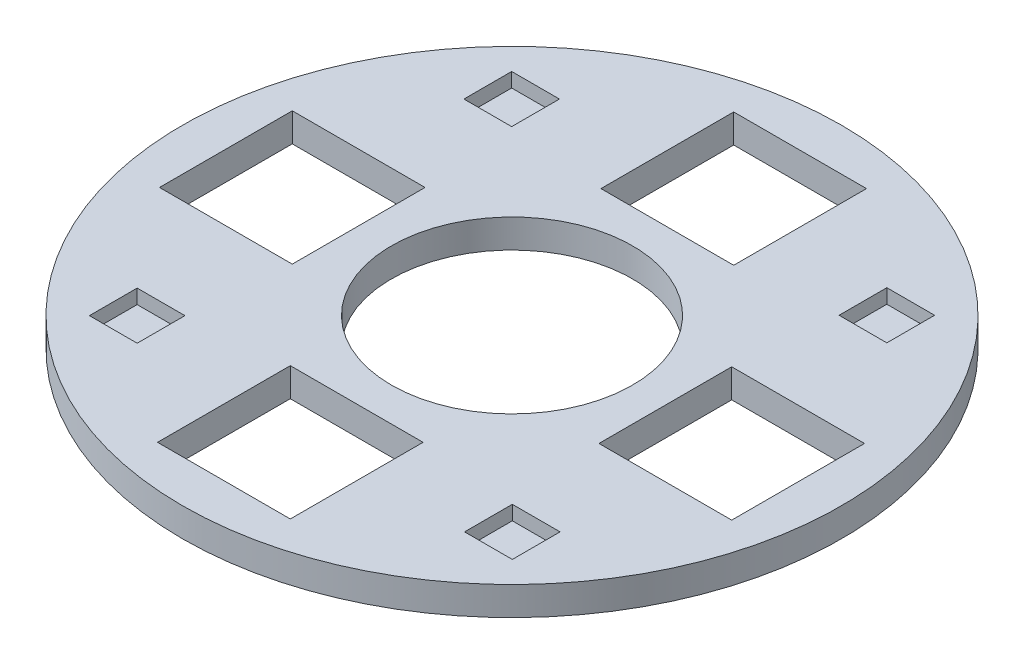
from build123d import *

# Parameters (mm, degrees)
SKETCH1_R           = 34.5
BOSS_EXTRUDE1_DEPTH = 3
SKETCH3_W           = 13.9
SKETCH3_H           = 13.9
CUT_EXTRUDE1_DEPTH  = 49.88251221
SKETCH4_R           = 12.627177327
CUT_EXTRUDE2_DEPTH  = 49.88251221
SKETCH5_W           = 5
SKETCH5_H           = 5
CUT_EXTRUDE3_DEPTH  = 1.5


with BuildPart() as part:
    # Sketch1 → Boss-Extrude1 (new body)
    with BuildSketch(Plane(origin=(0, 0, 0), x_dir=(1, 0, 0), z_dir=(0, 1, 0))):
        with Locations(Location((0, 0, 0), (0, 0, 270))):
            Circle(SKETCH1_R)
    extrude(amount=BOSS_EXTRUDE1_DEPTH)

    # Sketch3 → Cut-Extrude1 (cut, through all)
    with BuildSketch(Plane(origin=(0, 3, 0), x_dir=(1, 0, 0), z_dir=(0, 1, 0))):
        with Locations((23.105624339, -0.103761809)):
            Rectangle(SKETCH3_W, SKETCH3_H)
        with Locations((0.103761809, 23.105624339)):
            Rectangle(SKETCH3_W, SKETCH3_H)
        with Locations((-0.103761809, -23.105624339)):
            Rectangle(SKETCH3_W, SKETCH3_H)
        with Locations((-23.105624339, 0.103761809)):
            Rectangle(SKETCH3_W, SKETCH3_H)
    extrude(amount=-CUT_EXTRUDE1_DEPTH, mode=Mode.SUBTRACT)

    # Sketch4 → Cut-Extrude2 (cut, through all)
    with BuildSketch(Plane(origin=(0, 3, 0), x_dir=(1, 0, 0), z_dir=(0, 1, 0))):
        with Locations(Location((0, 0, 0), (0, 0, 270))):
            Circle(SKETCH4_R)
    extrude(amount=-CUT_EXTRUDE2_DEPTH, mode=Mode.SUBTRACT)

    # Sketch5 → Cut-Extrude3 (cut)
    with BuildSketch(Plane(origin=(0, 3, 0), x_dir=(1, 0, 0), z_dir=(0, 1, 0))):
        with Locations((19.603168608, 19.636741271)):
            Rectangle(SKETCH5_W, SKETCH5_H)
        with Locations((-19.636741271, 19.603168608)):
            Rectangle(SKETCH5_W, SKETCH5_H)
        with Locations((19.636741271, -19.603168608)):
            Rectangle(SKETCH5_W, SKETCH5_H)
        with Locations((-19.603168608, -19.636741271)):
            Rectangle(SKETCH5_W, SKETCH5_H)
    extrude(amount=-CUT_EXTRUDE3_DEPTH, mode=Mode.SUBTRACT)


solid = part.part
